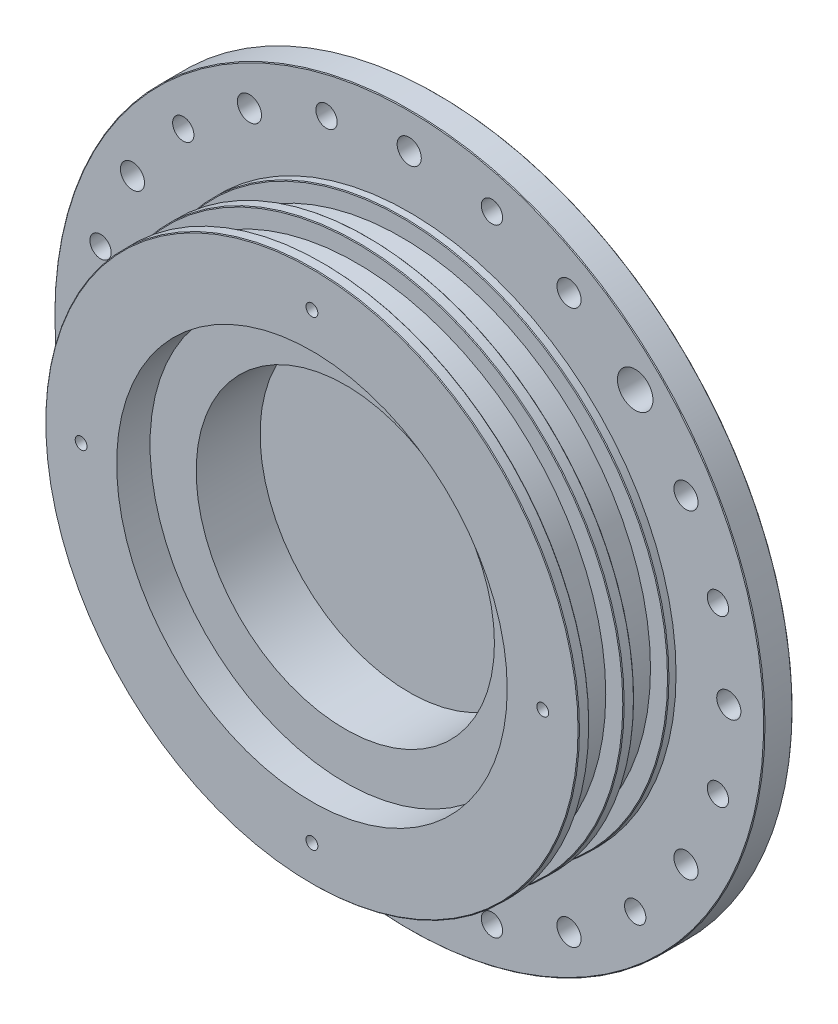
from build123d import *

# Parameters (mm, degrees)
DIAM_TRE_DU_PER_AGE_9_0_9_1_D     = 9
DIAM_TRE_DU_PER_AGE_9_0_9_1_DEPTH = 3
D_GAGEMENT_M31_D                  = 3.332
D_GAGEMENT_M31_DEPTH              = 16
D_GAGEMENT_M31_TIP                = 1.001033791
D_GAGEMENT_M1001_D                = 110
D_GAGEMENT_M1001_DEPTH            = 27.4
ESQUISSE8_R                       = 100
ESQUISSE8_R_2                     = 77.5
BOSS_EXTRU_1_DEPTH                = 8
ESQUISSE9_R                       = 3.4
ENL_V_MAT_EXTRU_1_DEPTH           = 20
ENL_V_MAT_EXTRU_15_DEPTH          = 146.784635679
ENL_V_MAT_EXTRU_15_DEPTH_BACK     = 146.784635679
ESQUISSE24_R                      = 3
ESQUISSE24_R_2                    = 5
CHANFREIN1_SIZE                   = 0.2
ENL_V_MAT_EXTRU_18_DEPTH          = 2
ESQUISSE35_R                      = 55
ESQUISSE35_R_2                    = 42
BOSS_EXTRU_4_DEPTH                = 18
BOSS_EXTRU_5_START                = -4
ESQUISSE36_R                      = 5
BOSS_EXTRU_5_DEPTH                = 4
ESQUISSE9_2_R                     = 3.4
ENL_V_MAT_EXTRU_20_DEPTH          = 20


with BuildPart() as part:
    # Esquisse1 → Révolution1 (revolve)
    with BuildSketch(Plane(origin=(0, 0, 0), x_dir=(1, 0, 0), z_dir=(0, 1, 0))):
        Polygon((87.5, 35.4), (0, 35.4), (0, 0), (75.15, 0), (75.15, 3), (70.15, 3), (70.15, 12.6), (75.15, 12.6), (75.15, 15.6), (70.15, 15.6), (70.15, 25.2), (75.15, 25.2), (75.15, 27.4), (87.5, 27.4), align=None)
    revolve(axis=Axis((0, 0, -35.4), (0, 0, 1)))

    # Diamètre du perçage Ø9.0 (9)1
    with Locations(Plane.XY.offset(-27.4)):
        with Locations((-87.5, 0), (0, 87.5), (0, -87.5), (87.5, 0)):
            Hole(DIAM_TRE_DU_PER_AGE_9_0_9_1_D / 2, depth=DIAM_TRE_DU_PER_AGE_9_0_9_1_DEPTH)

    # Dégagement M31
    with Locations(Plane.XY):
        with Locations((-65, 0), (65, 0), (0, 65), (0, -65)):
            Hole(D_GAGEMENT_M31_D / 2, depth=D_GAGEMENT_M31_DEPTH)
            with Locations((0, 0, -(D_GAGEMENT_M31_DEPTH + D_GAGEMENT_M31_TIP / 2))):  # 118° drill point
                Cone(0, D_GAGEMENT_M31_D / 2, D_GAGEMENT_M31_TIP, mode=Mode.SUBTRACT)

    # Dégagement M1001
    with Locations(Plane.XY):
        with Locations((0, 0)):
            Hole(D_GAGEMENT_M1001_D / 2, depth=D_GAGEMENT_M1001_DEPTH)

    # Esquisse8 → Boss.-Extru.1 (add)
    with BuildSketch(Plane(origin=(0, 0, -35.4), x_dir=(-1, 0, 0), z_dir=(0, 0, -1))):
        Circle(ESQUISSE8_R)
        Circle(ESQUISSE8_R_2, mode=Mode.SUBTRACT)
    extrude(amount=-BOSS_EXTRU_1_DEPTH)

    # Esquisse9 → Enlèv. mat.-Extru.1 (cut)
    with BuildSketch(Plane.XY.offset(-35.4)):
        with Locations((0, -50)):
            Circle(ESQUISSE9_R)
        with Locations((0, -90)):
            Circle(ESQUISSE9_R)
        with Locations((-25, -43.301270189)):
            Circle(ESQUISSE9_R)
        with Locations((-45, -77.942286341)):
            Circle(ESQUISSE9_R)
        with Locations((-43.301270189, -25)):
            Circle(ESQUISSE9_R)
        with Locations((-77.942286341, -45)):
            Circle(ESQUISSE9_R)
        with Locations((-50, 0)):
            Circle(ESQUISSE9_R)
        with Locations((-90, 0)):
            Circle(ESQUISSE9_R)
        with Locations((-43.301270189, 25)):
            Circle(ESQUISSE9_R)
        with Locations((-77.942286341, 45)):
            Circle(ESQUISSE9_R)
        with Locations((-25, 43.301270189)):
            Circle(ESQUISSE9_R)
        with Locations((-45, 77.942286341)):
            Circle(ESQUISSE9_R)
        with Locations((0, 50)):
            Circle(ESQUISSE9_R)
        with Locations((0, 90)):
            Circle(ESQUISSE9_R)
        with Locations((25, 43.301270189)):
            Circle(ESQUISSE9_R)
        with Locations((45, 77.942286341)):
            Circle(ESQUISSE9_R)
        with Locations((43.301270189, 25)):
            Circle(ESQUISSE9_R)
        with Locations((77.942286341, 45)):
            Circle(ESQUISSE9_R)
        with Locations((50, 0)):
            Circle(ESQUISSE9_R)
        with Locations((90, 0)):
            Circle(ESQUISSE9_R)
        with Locations((43.301270189, -25)):
            Circle(ESQUISSE9_R)
        with Locations((77.942286341, -45)):
            Circle(ESQUISSE9_R)
        with Locations((25, -43.301270189)):
            Circle(ESQUISSE9_R)
        with Locations((45, -77.942286341)):
            Circle(ESQUISSE9_R)
    extrude(amount=ENL_V_MAT_EXTRU_1_DEPTH, mode=Mode.SUBTRACT)

    # Esquisse24 → Enlèv. mat.-Extru.15 (cut, two sides: drawn at the far end of the back side and taken through both)
    with BuildSketch(Plane(origin=(0, 0, -35.4), x_dir=(-1, 0, 0), z_dir=(0, 0, -1)).offset(-ENL_V_MAT_EXTRU_15_DEPTH_BACK)):
        with Locations((23.293714059, 86.933324366)):
            Circle(ESQUISSE24_R)
        with Locations((63.639610307, 63.639610307)):
            Circle(ESQUISSE24_R)
        with Locations((86.933324366, 23.293714059)):
            Circle(ESQUISSE24_R)
        with Locations((86.933324366, -23.293714059)):
            Circle(ESQUISSE24_R)
        with Locations((-14, 24.248711306)):
            Circle(ESQUISSE24_R_2)
        with Locations((7.246933263, 27.045923136)):
            Circle(ESQUISSE24_R_2)
        with Locations((24.248711306, 14)):
            Circle(ESQUISSE24_R_2)
        with Locations((27.045923136, -7.246933263)):
            Circle(ESQUISSE24_R_2)
        with Locations((14, -24.248711306)):
            Circle(ESQUISSE24_R_2)
        with Locations((-7.246933263, -27.045923136)):
            Circle(ESQUISSE24_R_2)
        with Locations((-24.248711306, -14)):
            Circle(ESQUISSE24_R_2)
        with Locations((-27.045923136, 7.246933263)):
            Circle(ESQUISSE24_R_2)
        with Locations((-63.639610307, 63.639610307)):
            Circle(ESQUISSE24_R_2)
        with Locations((63.639610307, -63.639610307)):
            Circle(ESQUISSE24_R)
        with Locations((23.293714059, -86.933324366)):
            Circle(ESQUISSE24_R)
        with Locations((-23.293714059, -86.933324366)):
            Circle(ESQUISSE24_R)
        with Locations((-63.639610307, -63.639610307)):
            Circle(ESQUISSE24_R)
        with Locations((-86.933324366, -23.293714059)):
            Circle(ESQUISSE24_R)
        with Locations((-86.933324366, 23.293714059)):
            Circle(ESQUISSE24_R)
        with Locations((-23.293714059, 86.933324366)):
            Circle(ESQUISSE24_R)
    extrude(amount=ENL_V_MAT_EXTRU_15_DEPTH + ENL_V_MAT_EXTRU_15_DEPTH_BACK, mode=Mode.SUBTRACT)

    # Chanfrein1
    chanfrein1_edges = [part.edges().sort_by_distance(p)[0] for p in [
        (-75.15, 0, -25.2),
        (-75.15, 0, -3),
        (-75.15, 0, -12.6),
        (-75.15, 0, -15.6),
        (100, 0, -35.4),
        (100, 0, -27.4),
        (-75.15, 0, 0),
    ]]
    chamfer(chanfrein1_edges, length=CHANFREIN1_SIZE)

    # Esquisse25 → Enlèv. mat.-Extru.18 (cut)
    with BuildSketch(Plane(origin=(0, 0, -35.4), x_dir=(-1, 0, 0), z_dir=(0, 0, -1))):
        with BuildLine():
            Line((-22.534674305, 14.423884843), (-27.364303436, 15.717980069))
            ThreePointArc((-27.364303436, 15.717980069), (-27.626062148, 15.80113362), (-27.879119212, 15.907877515))
            ThreePointArc((-27.879119212, 15.907877515), (-29.43732897, 16.188098003), (-30.921195595, 15.636118826))
            ThreePointArc((-30.921195595, 15.636118826), (-31.100803738, 15.516590499), (-31.288537773, 15.410279455))
            ThreePointArc((-31.288537773, 15.410279455), (-35.932440738, 9.628068478), (-34.801808286, 2.298575399))
            ThreePointArc((-34.801808286, 2.298575399), (-34.692381365, 2.112640317), (-34.596600313, 1.919321678))
            ThreePointArc((-34.596600313, 1.919321678), (-33.587523709, 0.699360376), (-32.09796423, 0.162933558))
            ThreePointArc((-32.09796423, 0.162933558), (-31.825438437, 0.128847951), (-31.557171967, 0.069981683))
            Line((-31.557171967, 0.069981683), (-26.727542836, -1.224113543))
            ThreePointArc((-26.727542836, -1.224113543), (-26.465784124, -1.307267094), (-26.212727061, -1.414010989))
            ThreePointArc((-26.212727061, -1.414010989), (-24.654517302, -1.694231477), (-23.170650678, -1.1422523))
            ThreePointArc((-23.170650678, -1.1422523), (-22.991042534, -1.022723973), (-22.803308499, -0.916412929))
            ThreePointArc((-22.803308499, -0.916412929), (-18.159405534, 4.865798048), (-19.290037986, 12.195291126))
            ThreePointArc((-19.290037986, 12.195291126), (-19.399464908, 12.381226209), (-19.495245959, 12.574544848))
            ThreePointArc((-19.495245959, 12.574544848), (-20.504322564, 13.79450615), (-21.993882042, 14.330932968))
            ThreePointArc((-21.993882042, 14.330932968), (-22.266407835, 14.365018575), (-22.534674305, 14.423884843))
        make_face()
        with BuildLine():
            Line((-5.735194229, 26.133647797), (-8.235194229, 30.463774815))
            ThreePointArc((-8.235194229, 30.463774815), (-8.36148715, 30.707664616), (-8.464946183, 30.962082313))
            ThreePointArc((-8.464946183, 30.962082313), (-9.368621062, 32.262048807), (-10.808181434, 32.92099274))
            ThreePointArc((-10.808181434, 32.92099274), (-11.019702861, 32.963475586), (-11.22762413, 33.021050335))
            ThreePointArc((-11.22762413, 33.021050335), (-18.6, 32.216145021), (-22.983256384, 26.233932888))
            ThreePointArc((-22.983256384, 26.233932888), (-23.037355824, 26.025080413), (-23.106325314, 25.820656061))
            ThreePointArc((-23.106325314, 25.820656061), (-23.255443313, 24.244488242), (-22.581476746, 22.811899593))
            ThreePointArc((-22.581476746, 22.811899593), (-22.412874073, 22.595092593), (-22.264805771, 22.363774815))
            Line((-22.264805771, 22.363774815), (-19.764805771, 18.033647797))
            ThreePointArc((-19.764805771, 18.033647797), (-19.63851285, 17.789757996), (-19.535053817, 17.535340299))
            ThreePointArc((-19.535053817, 17.535340299), (-18.631378938, 16.235373805), (-17.191818566, 15.576429871))
            ThreePointArc((-17.191818566, 15.576429871), (-16.980297139, 15.533947026), (-16.77237587, 15.476372277))
            ThreePointArc((-16.77237587, 15.476372277), (-9.4, 16.281277591), (-5.016743616, 22.263489724))
            ThreePointArc((-5.016743616, 22.263489724), (-4.962644176, 22.472342199), (-4.893674686, 22.676766551))
            ThreePointArc((-4.893674686, 22.676766551), (-4.744556687, 24.25293437), (-5.418523254, 25.685523019))
            ThreePointArc((-5.418523254, 25.685523019), (-5.587125927, 25.902330019), (-5.735194229, 26.133647797))
        make_face()
        with BuildLine():
            Line((14.423884843, 22.534674305), (15.717980069, 27.364303436))
            ThreePointArc((15.717980069, 27.364303436), (15.80113362, 27.626062148), (15.907877515, 27.879119212))
            ThreePointArc((15.907877515, 27.879119212), (16.188098003, 29.43732897), (15.636118826, 30.921195595))
            ThreePointArc((15.636118826, 30.921195595), (15.516590499, 31.100803738), (15.410279455, 31.288537773))
            ThreePointArc((15.410279455, 31.288537773), (9.628068478, 35.932440738), (2.298575399, 34.801808286))
            ThreePointArc((2.298575399, 34.801808286), (2.112640317, 34.692381365), (1.919321678, 34.596600313))
            ThreePointArc((1.919321678, 34.596600313), (0.699360376, 33.587523709), (0.162933558, 32.09796423))
            ThreePointArc((0.162933558, 32.09796423), (0.128847951, 31.825438437), (0.069981683, 31.557171967))
            Line((0.069981683, 31.557171967), (-1.224113543, 26.727542836))
            ThreePointArc((-1.224113543, 26.727542836), (-1.307267094, 26.465784124), (-1.414010989, 26.212727061))
            ThreePointArc((-1.414010989, 26.212727061), (-1.694231477, 24.654517302), (-1.1422523, 23.170650678))
            ThreePointArc((-1.1422523, 23.170650678), (-1.022723973, 22.991042534), (-0.916412929, 22.803308499))
            ThreePointArc((-0.916412929, 22.803308499), (4.865798048, 18.159405534), (12.195291126, 19.290037986))
            ThreePointArc((12.195291126, 19.290037986), (12.381226209, 19.399464908), (12.574544848, 19.495245959))
            ThreePointArc((12.574544848, 19.495245959), (13.79450615, 20.504322564), (14.330932968, 21.993882042))
            ThreePointArc((14.330932968, 21.993882042), (14.365018575, 22.266407835), (14.423884843, 22.534674305))
        make_face()
        with BuildLine():
            Line((26.133647797, 5.735194229), (30.463774815, 8.235194229))
            ThreePointArc((30.463774815, 8.235194229), (30.707664616, 8.36148715), (30.962082313, 8.464946183))
            ThreePointArc((30.962082313, 8.464946183), (32.262048807, 9.368621062), (32.92099274, 10.808181434))
            ThreePointArc((32.92099274, 10.808181434), (32.963475586, 11.019702861), (33.021050335, 11.22762413))
            ThreePointArc((33.021050335, 11.22762413), (32.216145021, 18.6), (26.233932888, 22.983256384))
            ThreePointArc((26.233932888, 22.983256384), (26.025080413, 23.037355824), (25.820656061, 23.106325314))
            ThreePointArc((25.820656061, 23.106325314), (24.244488242, 23.255443313), (22.811899593, 22.581476746))
            ThreePointArc((22.811899593, 22.581476746), (22.595092593, 22.412874073), (22.363774815, 22.264805771))
            Line((22.363774815, 22.264805771), (18.033647797, 19.764805771))
            ThreePointArc((18.033647797, 19.764805771), (17.789757996, 19.63851285), (17.535340299, 19.535053817))
            ThreePointArc((17.535340299, 19.535053817), (16.235373805, 18.631378938), (15.576429871, 17.191818566))
            ThreePointArc((15.576429871, 17.191818566), (15.533947026, 16.980297139), (15.476372277, 16.77237587))
            ThreePointArc((15.476372277, 16.77237587), (16.281277591, 9.4), (22.263489724, 5.016743616))
            ThreePointArc((22.263489724, 5.016743616), (22.472342199, 4.962644176), (22.676766551, 4.893674686))
            ThreePointArc((22.676766551, 4.893674686), (24.25293437, 4.744556687), (25.685523019, 5.418523254))
            ThreePointArc((25.685523019, 5.418523254), (25.902330019, 5.587125927), (26.133647797, 5.735194229))
        make_face()
        with BuildLine():
            Line((22.534674305, -14.423884843), (27.364303436, -15.717980069))
            ThreePointArc((27.364303436, -15.717980069), (27.626062148, -15.80113362), (27.879119212, -15.907877515))
            ThreePointArc((27.879119212, -15.907877515), (29.43732897, -16.188098003), (30.921195595, -15.636118826))
            ThreePointArc((30.921195595, -15.636118826), (31.100803738, -15.516590499), (31.288537773, -15.410279455))
            ThreePointArc((31.288537773, -15.410279455), (35.932440738, -9.628068478), (34.801808286, -2.298575399))
            ThreePointArc((34.801808286, -2.298575399), (34.692381365, -2.112640317), (34.596600313, -1.919321678))
            ThreePointArc((34.596600313, -1.919321678), (33.587523709, -0.699360376), (32.09796423, -0.162933558))
            ThreePointArc((32.09796423, -0.162933558), (31.825438437, -0.128847951), (31.557171967, -0.069981683))
            Line((31.557171967, -0.069981683), (26.727542836, 1.224113543))
            ThreePointArc((26.727542836, 1.224113543), (26.465784124, 1.307267094), (26.212727061, 1.414010989))
            ThreePointArc((26.212727061, 1.414010989), (24.654517302, 1.694231477), (23.170650678, 1.1422523))
            ThreePointArc((23.170650678, 1.1422523), (22.991042534, 1.022723973), (22.803308499, 0.916412929))
            ThreePointArc((22.803308499, 0.916412929), (18.159405534, -4.865798048), (19.290037986, -12.195291126))
            ThreePointArc((19.290037986, -12.195291126), (19.399464908, -12.381226209), (19.495245959, -12.574544848))
            ThreePointArc((19.495245959, -12.574544848), (20.504322564, -13.79450615), (21.993882042, -14.330932968))
            ThreePointArc((21.993882042, -14.330932968), (22.266407835, -14.365018575), (22.534674305, -14.423884843))
        make_face()
        with BuildLine():
            Line((5.735194229, -26.133647797), (8.235194229, -30.463774815))
            ThreePointArc((8.235194229, -30.463774815), (8.36148715, -30.707664616), (8.464946183, -30.962082313))
            ThreePointArc((8.464946183, -30.962082313), (9.368621062, -32.262048807), (10.808181434, -32.92099274))
            ThreePointArc((10.808181434, -32.92099274), (11.019702861, -32.963475586), (11.22762413, -33.021050335))
            ThreePointArc((11.22762413, -33.021050335), (18.6, -32.216145021), (22.983256384, -26.233932888))
            ThreePointArc((22.983256384, -26.233932888), (23.037355824, -26.025080413), (23.106325314, -25.820656061))
            ThreePointArc((23.106325314, -25.820656061), (23.255443313, -24.244488242), (22.581476746, -22.811899593))
            ThreePointArc((22.581476746, -22.811899593), (22.412874073, -22.595092593), (22.264805771, -22.363774815))
            Line((22.264805771, -22.363774815), (19.764805771, -18.033647797))
            ThreePointArc((19.764805771, -18.033647797), (19.63851285, -17.789757996), (19.535053817, -17.535340299))
            ThreePointArc((19.535053817, -17.535340299), (18.631378938, -16.235373805), (17.191818566, -15.576429871))
            ThreePointArc((17.191818566, -15.576429871), (16.980297139, -15.533947026), (16.77237587, -15.476372277))
            ThreePointArc((16.77237587, -15.476372277), (9.4, -16.281277591), (5.016743616, -22.263489724))
            ThreePointArc((5.016743616, -22.263489724), (4.962644176, -22.472342199), (4.893674686, -22.676766551))
            ThreePointArc((4.893674686, -22.676766551), (4.744556687, -24.25293437), (5.418523254, -25.685523019))
            ThreePointArc((5.418523254, -25.685523019), (5.587125927, -25.902330019), (5.735194229, -26.133647797))
        make_face()
        with BuildLine():
            Line((-14.423884843, -22.534674305), (-15.717980069, -27.364303436))
            ThreePointArc((-15.717980069, -27.364303436), (-15.80113362, -27.626062148), (-15.907877515, -27.879119212))
            ThreePointArc((-15.907877515, -27.879119212), (-16.188098003, -29.43732897), (-15.636118826, -30.921195595))
            ThreePointArc((-15.636118826, -30.921195595), (-15.516590499, -31.100803738), (-15.410279455, -31.288537773))
            ThreePointArc((-15.410279455, -31.288537773), (-9.628068478, -35.932440738), (-2.298575399, -34.801808286))
            ThreePointArc((-2.298575399, -34.801808286), (-2.112640317, -34.692381365), (-1.919321678, -34.596600313))
            ThreePointArc((-1.919321678, -34.596600313), (-0.699360376, -33.587523709), (-0.162933558, -32.09796423))
            ThreePointArc((-0.162933558, -32.09796423), (-0.128847951, -31.825438437), (-0.069981683, -31.557171967))
            Line((-0.069981683, -31.557171967), (1.224113543, -26.727542836))
            ThreePointArc((1.224113543, -26.727542836), (1.307267094, -26.465784124), (1.414010989, -26.212727061))
            ThreePointArc((1.414010989, -26.212727061), (1.694231477, -24.654517302), (1.1422523, -23.170650678))
            ThreePointArc((1.1422523, -23.170650678), (1.022723973, -22.991042534), (0.916412929, -22.803308499))
            ThreePointArc((0.916412929, -22.803308499), (-4.865798048, -18.159405534), (-12.195291126, -19.290037986))
            ThreePointArc((-12.195291126, -19.290037986), (-12.381226209, -19.399464908), (-12.574544848, -19.495245959))
            ThreePointArc((-12.574544848, -19.495245959), (-13.79450615, -20.504322564), (-14.330932968, -21.993882042))
            ThreePointArc((-14.330932968, -21.993882042), (-14.365018575, -22.266407835), (-14.423884843, -22.534674305))
        make_face()
        with BuildLine():
            Line((-26.133647797, -5.735194229), (-30.463774815, -8.235194229))
            ThreePointArc((-30.463774815, -8.235194229), (-30.707664616, -8.36148715), (-30.962082313, -8.464946183))
            ThreePointArc((-30.962082313, -8.464946183), (-32.262048807, -9.368621062), (-32.92099274, -10.808181434))
            ThreePointArc((-32.92099274, -10.808181434), (-32.963475586, -11.019702861), (-33.021050335, -11.22762413))
            ThreePointArc((-33.021050335, -11.22762413), (-32.216145021, -18.6), (-26.233932888, -22.983256384))
            ThreePointArc((-26.233932888, -22.983256384), (-26.025080413, -23.037355824), (-25.820656061, -23.106325314))
            ThreePointArc((-25.820656061, -23.106325314), (-24.244488242, -23.255443313), (-22.811899593, -22.581476746))
            ThreePointArc((-22.811899593, -22.581476746), (-22.595092593, -22.412874073), (-22.363774815, -22.264805771))
            Line((-22.363774815, -22.264805771), (-18.033647797, -19.764805771))
            ThreePointArc((-18.033647797, -19.764805771), (-17.789757996, -19.63851285), (-17.535340299, -19.535053817))
            ThreePointArc((-17.535340299, -19.535053817), (-16.235373805, -18.631378938), (-15.576429871, -17.191818566))
            ThreePointArc((-15.576429871, -17.191818566), (-15.533947026, -16.980297139), (-15.476372277, -16.77237587))
            ThreePointArc((-15.476372277, -16.77237587), (-16.281277591, -9.4), (-22.263489724, -5.016743616))
            ThreePointArc((-22.263489724, -5.016743616), (-22.472342199, -4.962644176), (-22.676766551, -4.893674686))
            ThreePointArc((-22.676766551, -4.893674686), (-24.25293437, -4.744556687), (-25.685523019, -5.418523254))
            ThreePointArc((-25.685523019, -5.418523254), (-25.902330019, -5.587125927), (-26.133647797, -5.735194229))
        make_face()
    extrude(amount=-ENL_V_MAT_EXTRU_18_DEPTH, mode=Mode.SUBTRACT)

    # Esquisse35 → Boss.-Extru.4 (add)
    with BuildSketch(Plane.XY.offset(-27.4)):
        Circle(ESQUISSE35_R)
        Circle(ESQUISSE35_R_2, mode=Mode.SUBTRACT)
    extrude(amount=BOSS_EXTRU_4_DEPTH)

    # Esquisse36 → Boss.-Extru.5 (add)
    with BuildSketch(Plane.XY.offset(-27.4).offset(BOSS_EXTRU_5_START)):
        with Locations((-27.045923136, -7.246933263)):
            Circle(ESQUISSE36_R)
        with Locations((-24.248711306, 14)):
            Circle(ESQUISSE36_R)
        with Locations((-7.246933263, 27.045923136)):
            Circle(ESQUISSE36_R)
        with Locations((14, 24.248711306)):
            Circle(ESQUISSE36_R)
        with Locations((27.045923136, 7.246933263)):
            Circle(ESQUISSE36_R)
        with Locations((24.248711306, -14)):
            Circle(ESQUISSE36_R)
        with Locations((7.246933263, -27.045923136)):
            Circle(ESQUISSE36_R)
        with Locations((-14, -24.248711306)):
            Circle(ESQUISSE36_R)
    extrude(amount=BOSS_EXTRU_5_DEPTH)

    # Esquisse9<2> → Enlèv. mat.-Extru.20 (cut)
    with BuildSketch(Plane.XY.offset(-35.4)):
        with Locations((0, -50)):
            Circle(ESQUISSE9_2_R)
        with Locations((0, -90)):
            Circle(ESQUISSE9_2_R)
        with Locations((-25, -43.301270189)):
            Circle(ESQUISSE9_2_R)
        with Locations((-45, -77.942286341)):
            Circle(ESQUISSE9_2_R)
        with Locations((-43.301270189, -25)):
            Circle(ESQUISSE9_2_R)
        with Locations((-77.942286341, -45)):
            Circle(ESQUISSE9_2_R)
        with Locations((-50, 0)):
            Circle(ESQUISSE9_2_R)
        with Locations((-90, 0)):
            Circle(ESQUISSE9_2_R)
        with Locations((-43.301270189, 25)):
            Circle(ESQUISSE9_2_R)
        with Locations((-77.942286341, 45)):
            Circle(ESQUISSE9_2_R)
        with Locations((-25, 43.301270189)):
            Circle(ESQUISSE9_2_R)
        with Locations((-45, 77.942286341)):
            Circle(ESQUISSE9_2_R)
        with Locations((0, 50)):
            Circle(ESQUISSE9_2_R)
        with Locations((0, 90)):
            Circle(ESQUISSE9_2_R)
        with Locations((25, 43.301270189)):
            Circle(ESQUISSE9_2_R)
        with Locations((45, 77.942286341)):
            Circle(ESQUISSE9_2_R)
        with Locations((43.301270189, 25)):
            Circle(ESQUISSE9_2_R)
        with Locations((77.942286341, 45)):
            Circle(ESQUISSE9_2_R)
        with Locations((50, 0)):
            Circle(ESQUISSE9_2_R)
        with Locations((90, 0)):
            Circle(ESQUISSE9_2_R)
        with Locations((43.301270189, -25)):
            Circle(ESQUISSE9_2_R)
        with Locations((77.942286341, -45)):
            Circle(ESQUISSE9_2_R)
        with Locations((25, -43.301270189)):
            Circle(ESQUISSE9_2_R)
        with Locations((45, -77.942286341)):
            Circle(ESQUISSE9_2_R)
    extrude(amount=ENL_V_MAT_EXTRU_20_DEPTH, mode=Mode.SUBTRACT)


solid = part.part
